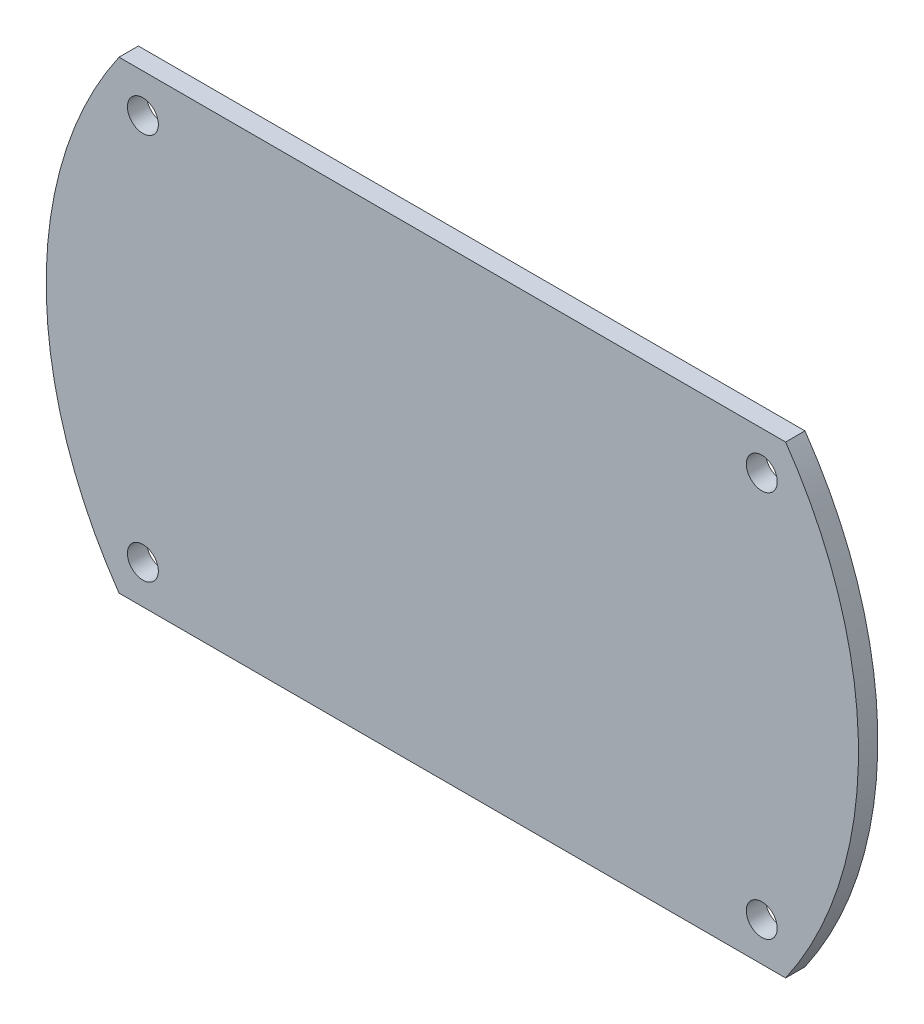
from build123d import *

# Parameters (mm, degrees)
ESQUISSE1_R             = 105
ESQUISSE1_R_2           = 4
BOSS_EXTRU_1_DEPTH      = 5
ESQUISSE2_W             = 250
ESQUISSE2_H             = 50
ENL_V_MAT_EXTRU_1_DEPTH = 149.576579581


with BuildPart() as part:
    # Esquisse1 → Boss.-Extru.1 (new body)
    with BuildSketch(Plane.XY):
        Circle(ESQUISSE1_R)
        with Locations((-80, 50)):
            Circle(ESQUISSE1_R_2, mode=Mode.SUBTRACT)
        with Locations(Location((80, 50, 0), (0, 0, 180))):
            Circle(ESQUISSE1_R_2, mode=Mode.SUBTRACT)
        with Locations((80, -50)):
            Circle(ESQUISSE1_R_2, mode=Mode.SUBTRACT)
        with Locations(Location((-80, -50, 0), (0, 0, 180))):
            Circle(ESQUISSE1_R_2, mode=Mode.SUBTRACT)
    extrude(amount=BOSS_EXTRU_1_DEPTH)

    # Esquisse2 → Enlèv. mat.-Extru.1 (cut, through all)
    with BuildSketch(Plane.XY.offset(5)):
        with Locations((0, 85)):
            Rectangle(ESQUISSE2_W, ESQUISSE2_H)
        with Locations((0, -85)):
            Rectangle(ESQUISSE2_W, ESQUISSE2_H)
    extrude(amount=-ENL_V_MAT_EXTRU_1_DEPTH, mode=Mode.SUBTRACT)


solid = part.part
